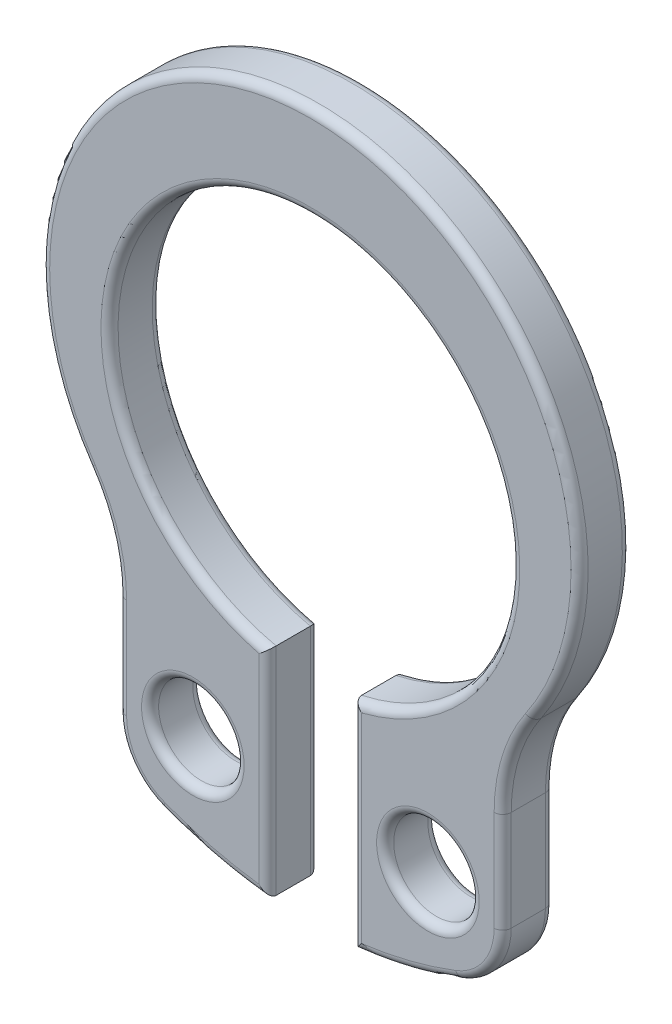
from build123d import *

# Parameters (mm, degrees)
SKETCH_1_R          = 3.15
SKETCH_1_R_2        = 2.35
EXTRUDE_1_DEPTH     = 0.6
EXTRUDE_START       = -0.6
EXTRUDE_2_DEPTH     = 0.6
CUT_EXTRUDE_START   = -0.6
SKETCH_3_R          = 0.5
CUT_EXTRUDE_1_DEPTH = 0.6
FILLET_1_R          = 0.8
FILLET_2_R          = 2
FILLET_3_R          = 0.1


with BuildPart() as part:
    # 草图1 → 凸台-拉伸1 (new body)
    with BuildSketch(Plane.XY):
        with Locations((0, 0.3)):
            Circle(SKETCH_1_R)
        Circle(SKETCH_1_R_2, mode=Mode.SUBTRACT)
    extrude(amount=EXTRUDE_1_DEPTH)

    # 草图2 → 凸台-拉伸2 (add)
    with BuildSketch(Plane.XY.offset(0.6).offset(EXTRUDE_START)):
        with BuildLine():
            Line((2.25, -4.296510212), (2.25, -1.904540769))
            ThreePointArc((2.25, -1.904540769), (0, -2.85), (-2.25, -1.904540769))
            Line((-2.25, -1.904540769), (-2.25, -4.296510212))
            ThreePointArc((-2.25, -4.296510212), (0, -4.85), (2.25, -4.296510212))
        make_face()
    extrude(amount=EXTRUDE_2_DEPTH)

    # 草图3 → 切除-拉伸1 (cut)
    with BuildSketch(Plane.XY.offset(0.6).offset(CUT_EXTRUDE_START)):
        with Locations((1.375, -3.6)):
            Circle(SKETCH_3_R)
        with Locations(Location((-1.375, -3.6, 0), (0, 0, 180))):
            Circle(SKETCH_3_R)
        with BuildLine():
            Line((0.5, -4.824157958), (0.5, -2.296192501))
            ThreePointArc((0.5, -2.296192501), (0, -2.35), (-0.5, -2.296192501))
            Line((-0.5, -2.296192501), (-0.5, -4.824157958))
            ThreePointArc((-0.5, -4.824157958), (0, -4.85), (0.5, -4.824157958))
        make_face()
    extrude(amount=CUT_EXTRUDE_1_DEPTH, mode=Mode.SUBTRACT)

    # 圆角1
    fillet_1_edges = [part.edges().sort_by_distance(p)[0] for p in [
        (2.25, -4.296510212, 0.3),
        (-2.25, -4.296510212, 0.3),
    ]]
    fillet(fillet_1_edges, radius=FILLET_1_R)

    # 圆角2
    fillet_2_edges = [part.edges().sort_by_distance(p)[0] for p in [
        (-2.25, -1.904540769, 0.3),
        (2.25, -1.904540769, 0.3),
    ]]
    fillet(fillet_2_edges, radius=FILLET_2_R)

    # 圆角3
    fillet_3_edges = [part.edges().sort_by_distance(p)[0] for p in [
        (1.127938907, -4.717017471, 0.6),
        (1.127938907, -4.717017471, 0),
        (0, 2.35, 0.6),
        (0, 2.35, 0),
        (0.875, -3.6, 0),
        (0.875, -3.6, 0.6),
        (-0.875, -3.6, 0),
        (-0.875, -3.6, 0.6),
        (-0.5, -3.560175229, 0),
        (0.5, -3.560175229, 0),
        (0.5, -3.560175229, 0.6),
        (-0.5, -3.560175229, 0.6),
        (2.25, -3.195070997, 0.6),
        (-1.127938907, -4.717017471, 0.6),
        (-2.109217643, -4.234780259, 0.6),
        (2.109217643, -4.234780259, 0.6),
        (2.25, -3.195070997, 0),
        (-1.127938907, -4.717017471, 0),
        (-2.109217643, -4.234780259, 0),
        (2.109217643, -4.234780259, 0),
        (0, 3.45, 0),
        (0, 3.45, 0.6),
        (-2.25, -3.195070997, 0),
        (-2.25, -3.195070997, 0.6),
        (-2.339375642, -2.017410348, 0.6),
        (-2.339375642, -2.017410348, 0),
        (2.339375642, -2.017410348, 0.6),
        (2.339375642, -2.017410348, 0),
    ]]
    fillet(fillet_3_edges, radius=FILLET_3_R)


solid = part.part
